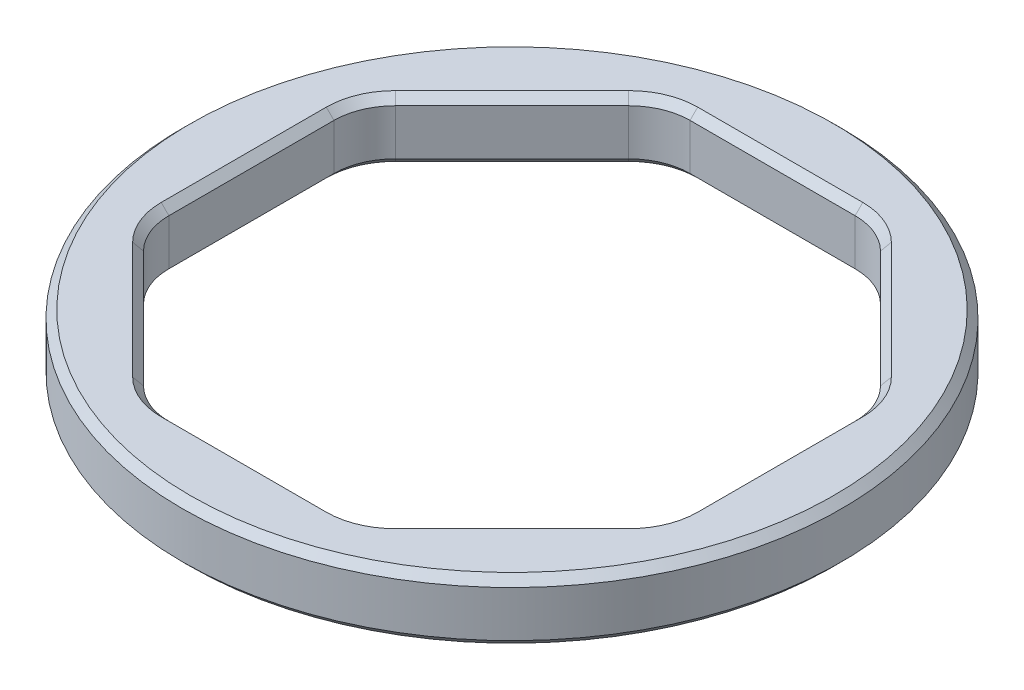
from build123d import *

# Parameters (mm, degrees)
SKETCH1_R           = 21.5
BOSS_EXTRUDE1_DEPTH = 4
CHAMFER1_SIZE       = 0.5


with BuildPart() as part:
    # Sketch1 → Boss-Extrude1 (new body)
    with BuildSketch(Plane(origin=(0, 0, 0), x_dir=(1, 0, 0), z_dir=(0, 1, 0))):
        with Locations(Location((0, 0, 0), (0, 0, 270))):
            Circle(SKETCH1_R)
        with BuildLine():
            Line((5.384776311, 17), (-5.384776311, 17))
            ThreePointArc((-5.384776311, 17), (-6.91551004, 16.69551813), (-8.213203436, 15.828427125))
            Line((-8.213203436, 15.828427125), (-15.828427125, 8.213203436))
            ThreePointArc((-15.828427125, 8.213203436), (-16.69551813, 6.91551004), (-17, 5.384776311))
            Line((-17, 5.384776311), (-17, -5.384776311))
            ThreePointArc((-17, -5.384776311), (-16.69551813, -6.91551004), (-15.828427125, -8.213203436))
            Line((-15.828427125, -8.213203436), (-8.213203436, -15.828427125))
            ThreePointArc((-8.213203436, -15.828427125), (-6.91551004, -16.69551813), (-5.384776311, -17))
            Line((-5.384776311, -17), (5.384776311, -17))
            ThreePointArc((5.384776311, -17), (6.91551004, -16.69551813), (8.213203436, -15.828427125))
            Line((8.213203436, -15.828427125), (15.828427125, -8.213203436))
            ThreePointArc((15.828427125, -8.213203436), (16.69551813, -6.91551004), (17, -5.384776311))
            Line((17, -5.384776311), (17, 5.384776311))
            ThreePointArc((17, 5.384776311), (16.69551813, 6.91551004), (15.828427125, 8.213203436))
            Line((15.828427125, 8.213203436), (8.213203436, 15.828427125))
            ThreePointArc((8.213203436, 15.828427125), (6.91551004, 16.69551813), (5.384776311, 17))
        make_face(mode=Mode.SUBTRACT)
    extrude(amount=BOSS_EXTRUDE1_DEPTH)

    # Chamfer1
    chamfer1_edges = [part.edges().sort_by_distance(p)[0] for p in [
        (-6.91551004, 0, -16.69551813),
        (-12.02081528, 0, -12.02081528),
        (0, 0, -21.5),
        (-16.69551813, 0, -6.91551004),
        (-17, 0, 0),
        (-16.69551813, 0, 6.91551004),
        (-12.02081528, 0, 12.02081528),
        (-6.91551004, 0, 16.69551813),
        (0, 0, 17),
        (6.91551004, 0, 16.69551813),
        (12.02081528, 0, 12.02081528),
        (16.69551813, 0, 6.91551004),
        (17, 0, 0),
        (16.69551813, 0, -6.91551004),
        (12.02081528, 0, -12.02081528),
        (6.91551004, 0, -16.69551813),
        (0, 0, -17),
        (-6.91551004, 4, -16.69551813),
        (-12.02081528, 4, -12.02081528),
        (-16.69551813, 4, -6.91551004),
        (-17, 4, 0),
        (-16.69551813, 4, 6.91551004),
        (-12.02081528, 4, 12.02081528),
        (-6.91551004, 4, 16.69551813),
        (0, 4, 17),
        (6.91551004, 4, 16.69551813),
        (12.02081528, 4, 12.02081528),
        (16.69551813, 4, 6.91551004),
        (17, 4, 0),
        (16.69551813, 4, -6.91551004),
        (12.02081528, 4, -12.02081528),
        (6.91551004, 4, -16.69551813),
        (0, 4, -17),
        (0, 4, -21.5),
    ]]
    chamfer(chamfer1_edges, length=CHAMFER1_SIZE)


solid = part.part
